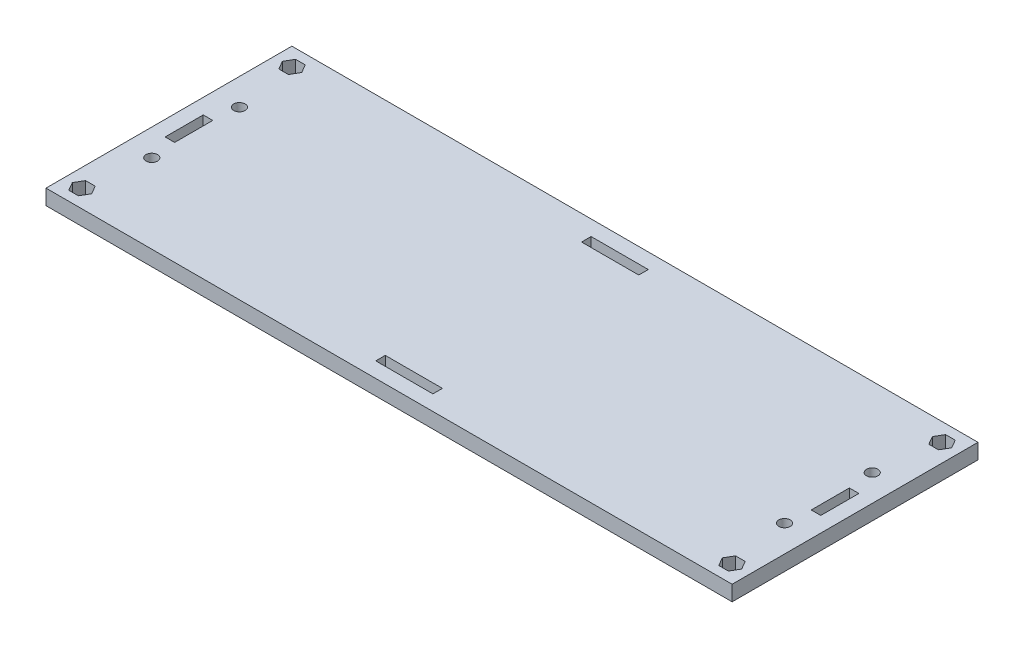
from build123d import *

# Parameters (mm, degrees)
CROQUIS1_W              = 180
CROQUIS1_H              = 64.5
SALIENTE_EXTRUIR1_DEPTH = 4
CROQUIS2_W              = 2.5
CROQUIS2_H              = 10
CORTAR_EXTRUIR1_DEPTH   = 4
MATRIZL1_COUNT          = 2
MATRIZL1_PITCH          = 169.5
CROQUIS3_W              = 15
CROQUIS3_H              = 2.5
CORTAR_EXTRUIR2_DEPTH   = 4
CORTAR_EXTRUIR3_DEPTH   = 4
MATRIZL2_COUNT          = 2
MATRIZL2_PITCH          = 170.52
MATRIZL2_COUNT_DIR2     = 2
MATRIZL2_PITCH_DIR2     = 55.1
CROQUIS5_R              = 1.5
CORTAR_EXTRUIR4_DEPTH   = 4


with BuildPart() as part:
    # Croquis1 → Saliente-Extruir1 (new body)
    with BuildSketch(Plane(origin=(0, 0, 0), x_dir=(1, 0, 0), z_dir=(0, 1, 0))):
        Rectangle(CROQUIS1_W, CROQUIS1_H)
    extrude(amount=SALIENTE_EXTRUIR1_DEPTH)

    # Croquis2 → Cortar-Extruir1 (cut)
    with BuildSketch(Plane(origin=(0, 4, 0), x_dir=(1, 0, 0), z_dir=(0, 1, 0))):
        with Locations((84.75, 0)):
            Rectangle(CROQUIS2_W, CROQUIS2_H)
    cortar_extruir1 = extrude(amount=-CORTAR_EXTRUIR1_DEPTH, mode=Mode.SUBTRACT)

    # MatrizL1: Cortar-Extruir1 ×2
    with Locations(*[(-i * MATRIZL1_PITCH, 0, 0) for i in range(1, MATRIZL1_COUNT)]):
        add(cortar_extruir1, mode=Mode.SUBTRACT)

    # Croquis3 → Cortar-Extruir2 (cut)
    with BuildSketch(Plane(origin=(0, 0, 0), x_dir=(1, 0, 0), z_dir=(0, 1, 0))):
        with Locations((0, 27)):
            Rectangle(CROQUIS3_W, CROQUIS3_H)
        with Locations((0, -27)):
            Rectangle(CROQUIS3_W, CROQUIS3_H)
    extrude(amount=CORTAR_EXTRUIR2_DEPTH, mode=Mode.SUBTRACT)

    # Croquis4 → Cortar-Extruir3 (cut)
    with BuildSketch(Plane(origin=(0, 4, 0), x_dir=(1, 0, 0), z_dir=(0, 1, 0))):
        Polygon((-82.719317631, 27.55), (-83.989488223, 29.75), (-86.529829408, 29.75), (-87.8, 27.55), (-86.529829408, 25.35), (-83.989488223, 25.35), align=None)
    cortar_extruir3 = extrude(amount=-CORTAR_EXTRUIR3_DEPTH, mode=Mode.SUBTRACT)

    # MatrizL2: Cortar-Extruir3 2 × 2
    with Locations(*[(i * MATRIZL2_PITCH, 0, j * MATRIZL2_PITCH_DIR2) for i in range(MATRIZL2_COUNT) for j in range(MATRIZL2_COUNT_DIR2) if (i, j) != (0, 0)]):
        add(cortar_extruir3, mode=Mode.SUBTRACT)

    # Croquis5 → Cortar-Extruir4 (cut)
    with BuildSketch(Plane(origin=(0, 4, 0), x_dir=(1, 0, 0), z_dir=(0, 1, 0))):
        with Locations(Location((-83, 11.5, 0), (0, 0, 270))):
            Circle(CROQUIS5_R)
        with Locations(Location((-83, -11.5, 0), (0, 0, 270))):
            Circle(CROQUIS5_R)
        with Locations(Location((83, -11.5, 0), (0, 0, 270))):
            Circle(CROQUIS5_R)
        with Locations(Location((83, 11.5, 0), (0, 0, 270))):
            Circle(CROQUIS5_R)
    extrude(amount=-CORTAR_EXTRUIR4_DEPTH, mode=Mode.SUBTRACT)


solid = part.part
